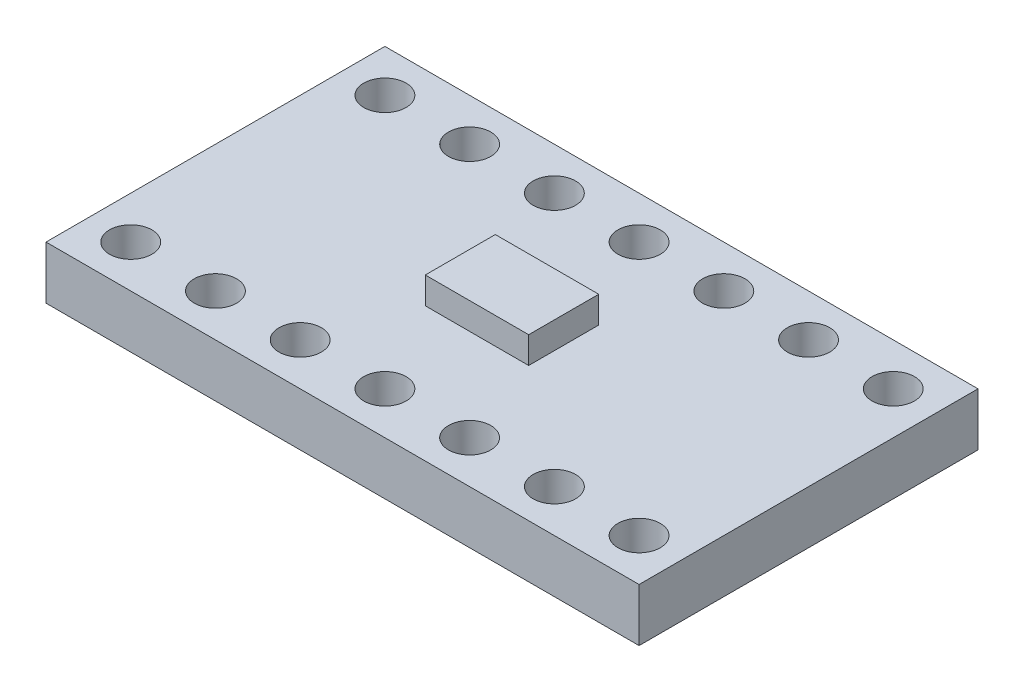
from build123d import *

# Parameters (mm, degrees)
SKETCH1_W           = 17.78
SKETCH1_H           = 10.16
BOSS_EXTRUDE1_DEPTH = 1.5875
SKETCH2_W           = 3.1
SKETCH2_H           = 2.1
BOSS_EXTRUDE2_DEPTH = 0.8
CUT_EXTRUDE1_REACH  = 12.361
SKETCH3_R           = 0.635


with BuildPart() as part:
    # Sketch1 → Boss-Extrude1 (new body)
    with BuildSketch(Plane(origin=(0, 0, 0), x_dir=(1, 0, 0), z_dir=(0, 1, 0))):
        Rectangle(SKETCH1_W, SKETCH1_H)
    extrude(amount=-BOSS_EXTRUDE1_DEPTH)

    # Sketch2 → Boss-Extrude2 (add)
    with BuildSketch(Plane(origin=(0, 0, 0), x_dir=(1, 0, 0), z_dir=(0, 1, 0))):
        Rectangle(SKETCH2_W, SKETCH2_H)
    extrude(amount=BOSS_EXTRUDE2_DEPTH)

    # Sketch3 → Cut-Extrude1 (cut, up to next)
    with BuildSketch(Plane(origin=(0, 0, 0), x_dir=(1, 0, 0), z_dir=(0, 1, 0)), mode=Mode.PRIVATE) as cut_extrude1_sk1:
        with Locations(Location((-7.62, 3.81, 0), (0, 0, 270))):
            Circle(SKETCH3_R)
    cut_extrude1_tool1 = extrude(cut_extrude1_sk1.sketch, amount=-CUT_EXTRUDE1_REACH, mode=Mode.PRIVATE) & part.part
    # Sketch3 → Cut-Extrude1 (cut, up to next)
    with BuildSketch(Plane(origin=(0, 0, 0), x_dir=(1, 0, 0), z_dir=(0, 1, 0)), mode=Mode.PRIVATE) as cut_extrude1_sk2:
        with Locations(Location((-7.62, -3.81, 0), (0, 0, 270))):
            Circle(SKETCH3_R)
    cut_extrude1_tool2 = extrude(cut_extrude1_sk2.sketch, amount=-CUT_EXTRUDE1_REACH, mode=Mode.PRIVATE) & part.part
    # Sketch3 → Cut-Extrude1 (cut, up to next)
    with BuildSketch(Plane(origin=(0, 0, 0), x_dir=(1, 0, 0), z_dir=(0, 1, 0)), mode=Mode.PRIVATE) as cut_extrude1_sk3:
        with Locations(Location((-5.08, 3.81, 0), (0, 0, 270))):
            Circle(SKETCH3_R)
    cut_extrude1_tool3 = extrude(cut_extrude1_sk3.sketch, amount=-CUT_EXTRUDE1_REACH, mode=Mode.PRIVATE) & part.part
    # Sketch3 → Cut-Extrude1 (cut, up to next)
    with BuildSketch(Plane(origin=(0, 0, 0), x_dir=(1, 0, 0), z_dir=(0, 1, 0)), mode=Mode.PRIVATE) as cut_extrude1_sk4:
        with Locations(Location((-5.08, -3.81, 0), (0, 0, 270))):
            Circle(SKETCH3_R)
    cut_extrude1_tool4 = extrude(cut_extrude1_sk4.sketch, amount=-CUT_EXTRUDE1_REACH, mode=Mode.PRIVATE) & part.part
    # Sketch3 → Cut-Extrude1 (cut, up to next)
    with BuildSketch(Plane(origin=(0, 0, 0), x_dir=(1, 0, 0), z_dir=(0, 1, 0)), mode=Mode.PRIVATE) as cut_extrude1_sk5:
        with Locations(Location((-2.54, 3.81, 0), (0, 0, 270))):
            Circle(SKETCH3_R)
    cut_extrude1_tool5 = extrude(cut_extrude1_sk5.sketch, amount=-CUT_EXTRUDE1_REACH, mode=Mode.PRIVATE) & part.part
    # Sketch3 → Cut-Extrude1 (cut, up to next)
    with BuildSketch(Plane(origin=(0, 0, 0), x_dir=(1, 0, 0), z_dir=(0, 1, 0)), mode=Mode.PRIVATE) as cut_extrude1_sk6:
        with Locations(Location((-2.54, -3.81, 0), (0, 0, 270))):
            Circle(SKETCH3_R)
    cut_extrude1_tool6 = extrude(cut_extrude1_sk6.sketch, amount=-CUT_EXTRUDE1_REACH, mode=Mode.PRIVATE) & part.part
    # Sketch3 → Cut-Extrude1 (cut, up to next)
    with BuildSketch(Plane(origin=(0, 0, 0), x_dir=(1, 0, 0), z_dir=(0, 1, 0)), mode=Mode.PRIVATE) as cut_extrude1_sk7:
        with Locations(Location((0, 3.81, 0), (0, 0, 270))):
            Circle(SKETCH3_R)
    cut_extrude1_tool7 = extrude(cut_extrude1_sk7.sketch, amount=-CUT_EXTRUDE1_REACH, mode=Mode.PRIVATE) & part.part
    # Sketch3 → Cut-Extrude1 (cut, up to next)
    with BuildSketch(Plane(origin=(0, 0, 0), x_dir=(1, 0, 0), z_dir=(0, 1, 0)), mode=Mode.PRIVATE) as cut_extrude1_sk8:
        with Locations(Location((0, -3.81, 0), (0, 0, 270))):
            Circle(SKETCH3_R)
    cut_extrude1_tool8 = extrude(cut_extrude1_sk8.sketch, amount=-CUT_EXTRUDE1_REACH, mode=Mode.PRIVATE) & part.part
    # Sketch3 → Cut-Extrude1 (cut, up to next)
    with BuildSketch(Plane(origin=(0, 0, 0), x_dir=(1, 0, 0), z_dir=(0, 1, 0)), mode=Mode.PRIVATE) as cut_extrude1_sk9:
        with Locations(Location((2.54, 3.81, 0), (0, 0, 270))):
            Circle(SKETCH3_R)
    cut_extrude1_tool9 = extrude(cut_extrude1_sk9.sketch, amount=-CUT_EXTRUDE1_REACH, mode=Mode.PRIVATE) & part.part
    # Sketch3 → Cut-Extrude1 (cut, up to next)
    with BuildSketch(Plane(origin=(0, 0, 0), x_dir=(1, 0, 0), z_dir=(0, 1, 0)), mode=Mode.PRIVATE) as cut_extrude1_sk10:
        with Locations(Location((2.54, -3.81, 0), (0, 0, 270))):
            Circle(SKETCH3_R)
    cut_extrude1_tool10 = extrude(cut_extrude1_sk10.sketch, amount=-CUT_EXTRUDE1_REACH, mode=Mode.PRIVATE) & part.part
    # Sketch3 → Cut-Extrude1 (cut, up to next)
    with BuildSketch(Plane(origin=(0, 0, 0), x_dir=(1, 0, 0), z_dir=(0, 1, 0)), mode=Mode.PRIVATE) as cut_extrude1_sk11:
        with Locations(Location((5.08, 3.81, 0), (0, 0, 270))):
            Circle(SKETCH3_R)
    cut_extrude1_tool11 = extrude(cut_extrude1_sk11.sketch, amount=-CUT_EXTRUDE1_REACH, mode=Mode.PRIVATE) & part.part
    # Sketch3 → Cut-Extrude1 (cut, up to next)
    with BuildSketch(Plane(origin=(0, 0, 0), x_dir=(1, 0, 0), z_dir=(0, 1, 0)), mode=Mode.PRIVATE) as cut_extrude1_sk12:
        with Locations(Location((5.08, -3.81, 0), (0, 0, 270))):
            Circle(SKETCH3_R)
    cut_extrude1_tool12 = extrude(cut_extrude1_sk12.sketch, amount=-CUT_EXTRUDE1_REACH, mode=Mode.PRIVATE) & part.part
    # Sketch3 → Cut-Extrude1 (cut, up to next)
    with BuildSketch(Plane(origin=(0, 0, 0), x_dir=(1, 0, 0), z_dir=(0, 1, 0)), mode=Mode.PRIVATE) as cut_extrude1_sk13:
        with Locations(Location((7.62, 3.81, 0), (0, 0, 270))):
            Circle(SKETCH3_R)
    cut_extrude1_tool13 = extrude(cut_extrude1_sk13.sketch, amount=-CUT_EXTRUDE1_REACH, mode=Mode.PRIVATE) & part.part
    # Sketch3 → Cut-Extrude1 (cut, up to next)
    with BuildSketch(Plane(origin=(0, 0, 0), x_dir=(1, 0, 0), z_dir=(0, 1, 0)), mode=Mode.PRIVATE) as cut_extrude1_sk14:
        with Locations(Location((7.62, -3.81, 0), (0, 0, 270))):
            Circle(SKETCH3_R)
    cut_extrude1_tool14 = extrude(cut_extrude1_sk14.sketch, amount=-CUT_EXTRUDE1_REACH, mode=Mode.PRIVATE) & part.part
    add(cut_extrude1_tool1.solids().sort_by_distance((-7.62, 0, -3.81))[0], mode=Mode.SUBTRACT)
    add(cut_extrude1_tool2.solids().sort_by_distance((-7.62, 0, 3.81))[0], mode=Mode.SUBTRACT)
    add(cut_extrude1_tool3.solids().sort_by_distance((-5.08, 0, -3.81))[0], mode=Mode.SUBTRACT)
    add(cut_extrude1_tool4.solids().sort_by_distance((-5.08, 0, 3.81))[0], mode=Mode.SUBTRACT)
    add(cut_extrude1_tool5.solids().sort_by_distance((-2.54, 0, -3.81))[0], mode=Mode.SUBTRACT)
    add(cut_extrude1_tool6.solids().sort_by_distance((-2.54, 0, 3.81))[0], mode=Mode.SUBTRACT)
    add(cut_extrude1_tool7.solids().sort_by_distance((0, 0, -3.81))[0], mode=Mode.SUBTRACT)
    add(cut_extrude1_tool8.solids().sort_by_distance((0, 0, 3.81))[0], mode=Mode.SUBTRACT)
    add(cut_extrude1_tool9.solids().sort_by_distance((2.54, 0, -3.81))[0], mode=Mode.SUBTRACT)
    add(cut_extrude1_tool10.solids().sort_by_distance((2.54, 0, 3.81))[0], mode=Mode.SUBTRACT)
    add(cut_extrude1_tool11.solids().sort_by_distance((5.08, 0, -3.81))[0], mode=Mode.SUBTRACT)
    add(cut_extrude1_tool12.solids().sort_by_distance((5.08, 0, 3.81))[0], mode=Mode.SUBTRACT)
    add(cut_extrude1_tool13.solids().sort_by_distance((7.62, 0, -3.81))[0], mode=Mode.SUBTRACT)
    add(cut_extrude1_tool14.solids().sort_by_distance((7.62, 0, 3.81))[0], mode=Mode.SUBTRACT)


solid = part.part
